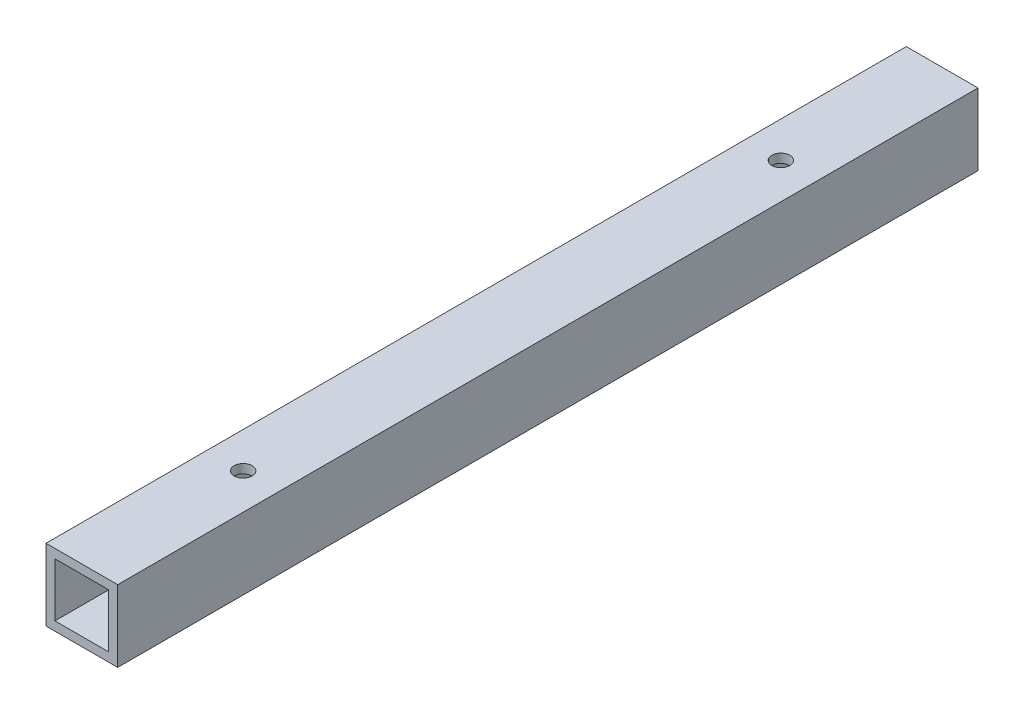
from build123d import *

# Parameters (mm, degrees)
BOSS_EXTRUDE1_DEPTH      = 152.4
BOSS_EXTRUDE1_DEPTH_BACK = 152.4
SKETCH3_W                = 25.4
SKETCH3_H                = 25.4
SKETCH3_W_2              = 19.05
SKETCH3_H_2              = 19.05
SKETCH6_R                = 3.175
CUT_EXTRUDE1_DEPTH       = 156.02325632


with BuildPart() as part:
    # Sketch3 → Boss-Extrude1 (new, two sides: drawn at the far end of the back side and taken through both)
    with BuildSketch(Plane.XY.offset(-BOSS_EXTRUDE1_DEPTH_BACK)):
        Rectangle(SKETCH3_W, SKETCH3_H)
        Rectangle(SKETCH3_W_2, SKETCH3_H_2, mode=Mode.SUBTRACT)
    extrude(amount=BOSS_EXTRUDE1_DEPTH + BOSS_EXTRUDE1_DEPTH_BACK)

    # Sketch6 → Cut-Extrude1 (cut, through all)
    with BuildSketch(Plane(origin=(0, 12.7, 0), x_dir=(1, 0, 0), z_dir=(0, 1, 0))):
        with Locations(Location((0, -95.25, 0), (0, 0, 270))):
            Circle(SKETCH6_R)
        with Locations(Location((0, 95.25, 0), (0, 0, 90))):
            Circle(SKETCH6_R)
    extrude(amount=-CUT_EXTRUDE1_DEPTH, mode=Mode.SUBTRACT)


solid = part.part
